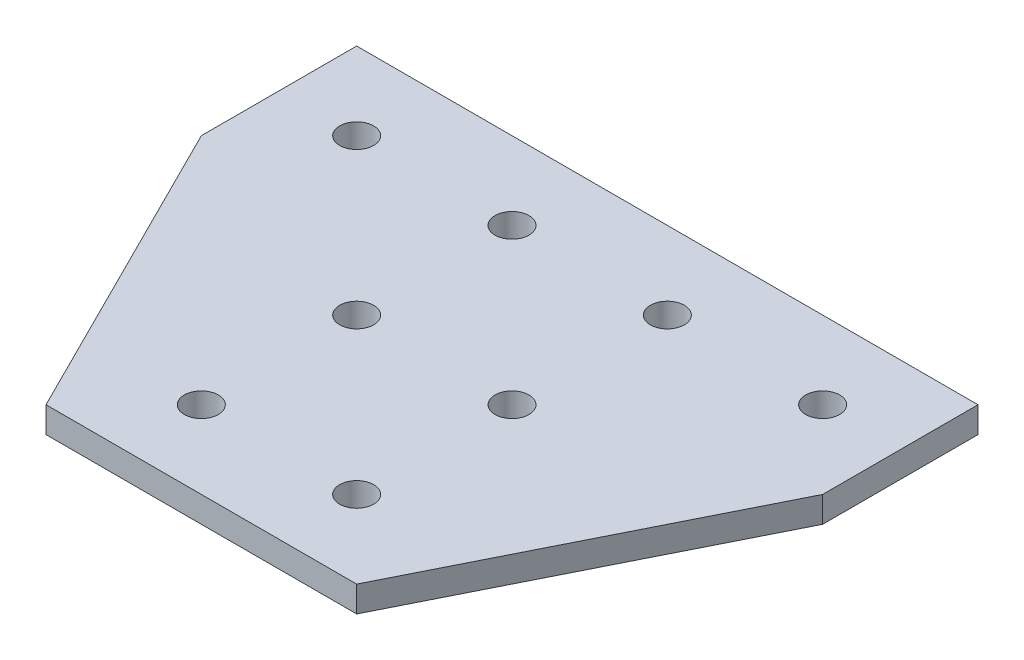
from build123d import *

# Parameters (mm, degrees)
SKETCH1_R           = 4.1656
BOSS_EXTRUDE1_DEPTH = 6.35


with BuildPart() as part:
    # Sketch1 → Boss-Extrude1 (new body)
    with BuildSketch(Plane(origin=(0, 0, 0), x_dir=(1, 0, 0), z_dir=(0, 1, 0))):
        Polygon((0, 0), (-152.4, 0), (-152.4, -38.1), (-114.3, -114.3), (-38.1, -114.3), (0, -38.1), align=None)
        with Locations(Location((-95.25, -95.25, 0), (0, 0, 270))):
            Circle(SKETCH1_R, mode=Mode.SUBTRACT)
        with Locations(Location((-95.25, -57.15, 0), (0, 0, 270))):
            Circle(SKETCH1_R, mode=Mode.SUBTRACT)
        with Locations(Location((-133.35, -19.05, 0), (0, 0, 270))):
            Circle(SKETCH1_R, mode=Mode.SUBTRACT)
        with Locations(Location((-95.25, -19.05, 0), (0, 0, 270))):
            Circle(SKETCH1_R, mode=Mode.SUBTRACT)
        with Locations(Location((-57.15, -57.15, 0), (0, 0, 270))):
            Circle(SKETCH1_R, mode=Mode.SUBTRACT)
        with Locations(Location((-57.15, -95.25, 0), (0, 0, 270))):
            Circle(SKETCH1_R, mode=Mode.SUBTRACT)
        with Locations(Location((-57.15, -19.05, 0), (0, 0, 270))):
            Circle(SKETCH1_R, mode=Mode.SUBTRACT)
        with Locations(Location((-19.05, -19.05, 0), (0, 0, 270))):
            Circle(SKETCH1_R, mode=Mode.SUBTRACT)
    extrude(amount=-BOSS_EXTRUDE1_DEPTH)


solid = part.part
